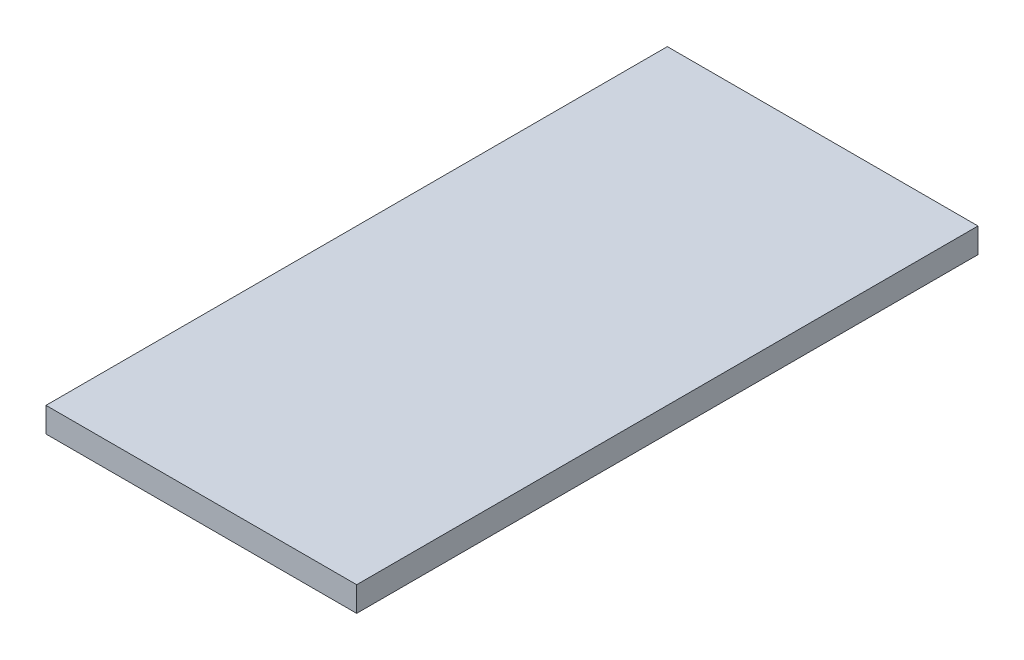
from build123d import *

# Parameters (mm, degrees)
SKETCH1_W           = 200
SKETCH1_H           = 400
BOSS_EXTRUDE1_DEPTH = 16


with BuildPart() as part:
    # Sketch1 → Boss-Extrude1 (new body)
    with BuildSketch(Plane(origin=(0, 0, 0), x_dir=(1, 0, 0), z_dir=(0, 1, 0))):
        Rectangle(SKETCH1_W, SKETCH1_H)
    extrude(amount=BOSS_EXTRUDE1_DEPTH)


solid = part.part
